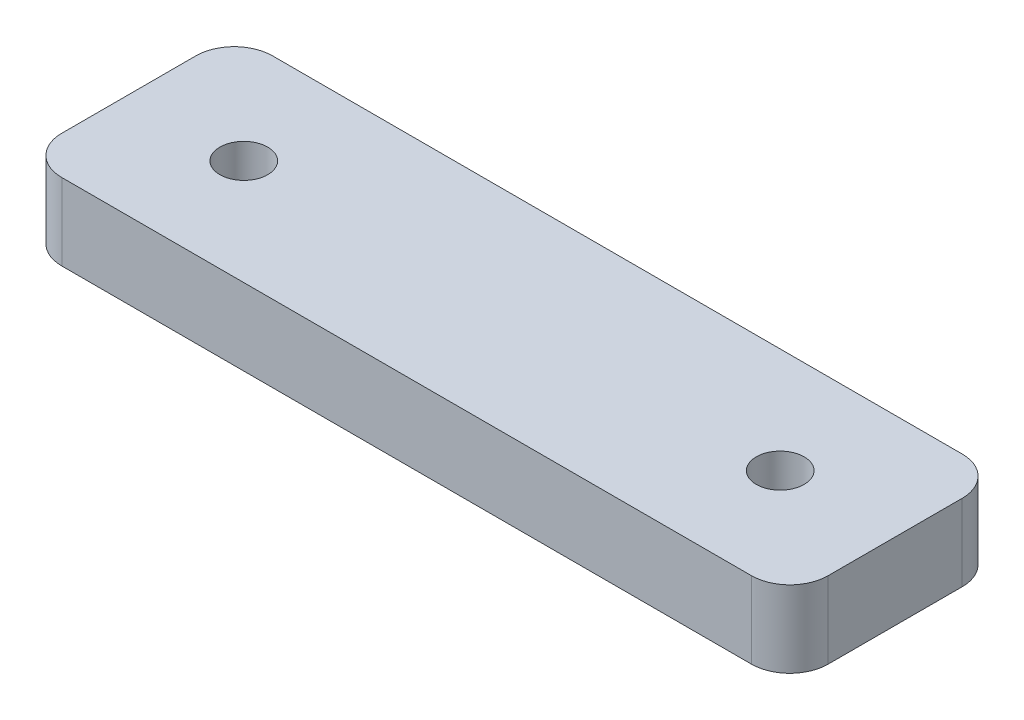
from build123d import *

# Parameters (mm, degrees)
CROQUIS1_W              = 20
CROQUIS1_H              = 5.5
CROQUIS1_R              = 0.625
SALIENTE_EXTRUIR1_DEPTH = 2
REDONDEO1_R             = 1


with BuildPart() as part:
    # Croquis1 → Saliente-Extruir1 (new body)
    with BuildSketch(Plane(origin=(0, 0, 0), x_dir=(1, 0, 0), z_dir=(0, 1, 0))):
        Rectangle(CROQUIS1_W, CROQUIS1_H)
        with Locations(Location((-7, 0, 0), (0, 0, 270))):
            Circle(CROQUIS1_R, mode=Mode.SUBTRACT)
        with Locations(Location((7, 0, 0), (0, 0, 90))):
            Circle(CROQUIS1_R, mode=Mode.SUBTRACT)
    extrude(amount=SALIENTE_EXTRUIR1_DEPTH)

    # Redondeo1
    redondeo1_edges = [part.edges().sort_by_distance(p)[0] for p in [
        (10, 1, 2.75),
        (-10, 1, 2.75),
        (-10, 1, -2.75),
        (10, 1, -2.75),
    ]]
    fillet(redondeo1_edges, radius=REDONDEO1_R)


solid = part.part
